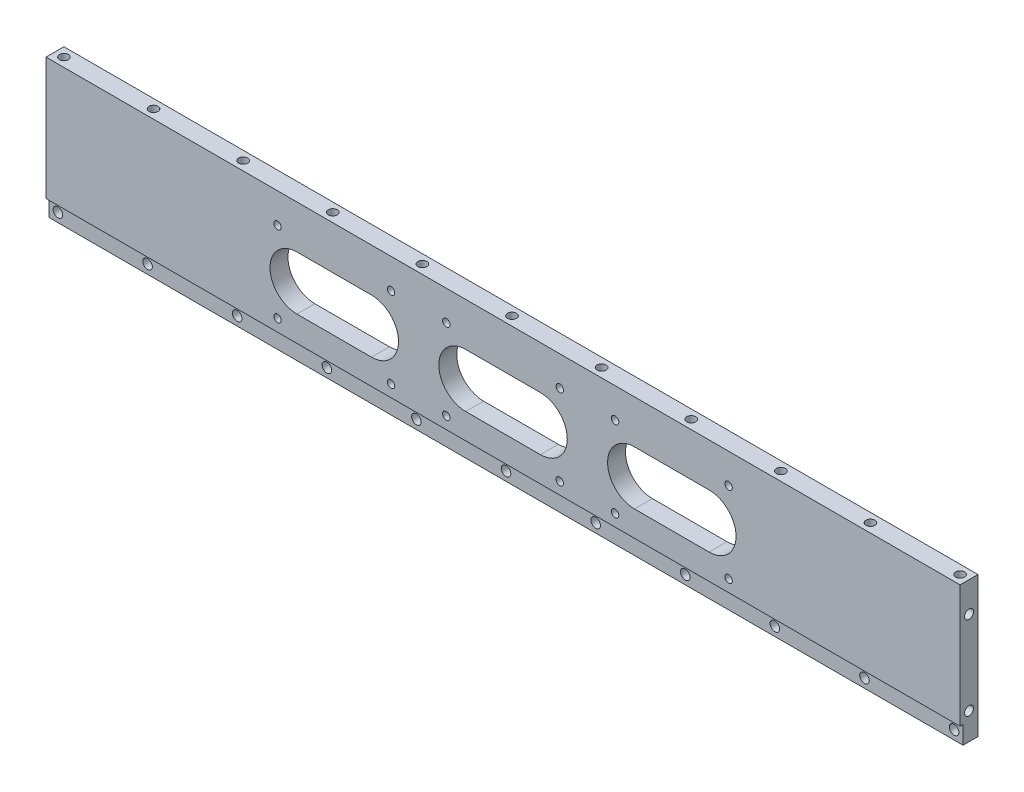
from build123d import *

# Parameters (mm, degrees)
SKETCH_1_W                     = 306
SKETCH_1_H                     = 47
EXTRUDE_1_DEPTH                = 3
CUT_EXTRUDE_START              = 3
SKETCH_1_4_W                   = 306
SKETCH_1_4_H                   = 6
CUT_EXTRUDE_1_DEPTH            = 1
M3X0_5_3_D                     = 2.5
M3X0_5_3_DEPTH                 = 8.5
M3X0_5_3_CBORE_D               = 3
M3X0_5_3_CBORE_DEPTH           = 6
M3X0_5_3_TIP                   = 0.751075774
M3X0_5_3_ON_FACE_2_D           = 2.5
M3X0_5_3_ON_FACE_2_DEPTH       = 8.5
M3X0_5_3_ON_FACE_2_CBORE_D     = 3
M3X0_5_3_ON_FACE_2_CBORE_DEPTH = 6
M3X0_5_3_ON_FACE_2_TIP         = 0.751075774
PATTERN_LINEAR_1_COUNT         = 11
PATTERN_LINEAR_1_PITCH         = 30
SKETCH_7_R                     = 1.25
CUT_EXTRUDE_2_DEPTH            = 155.910458106


with BuildPart() as part:
    # ｽｹｯﾁ1 → ﾎﾞｽ - 押し出し1 (new, symmetric)
    with BuildSketch(Plane.XY):
        Rectangle(SKETCH_1_W, SKETCH_1_H)
    extrude(amount=EXTRUDE_1_DEPTH, both=True)

    # ｽｹｯﾁ1<4> → ｶｯﾄ - 押し出し1 (cut)
    with BuildSketch(Plane.XY.offset(CUT_EXTRUDE_START)):
        with Locations((0, -20.5)):
            Rectangle(SKETCH_1_4_W, SKETCH_1_4_H)
    extrude(amount=-CUT_EXTRUDE_1_DEPTH, mode=Mode.SUBTRACT)

    # ｽｹｯﾁ2 → M3 すきま穴1 (revolve, cut)
    with BuildSketch(Plane(origin=(-150, -20.5, -3), x_dir=(0, 1, 0), z_dir=(1, 0, 0))):
        Polygon((0, 0), (0, 6.96137699), (1.6, 6), (1.6, 0), align=None)
    hole_wizard_m3_1 = revolve(axis=Axis((-150, -20.5, -9.35), (0, 0, 1)), mode=Mode.SUBTRACT)

    # M3x0.5 ねじ穴3
    with Locations(Plane(origin=(-153, 13.5, 0), x_dir=(0, 0, -1), z_dir=(-1, 0, 0))):
        with Locations((0, 0), (0, 28)):
            CounterBoreHole(M3X0_5_3_D / 2, M3X0_5_3_CBORE_D / 2, M3X0_5_3_CBORE_DEPTH, depth=M3X0_5_3_DEPTH)
            with Locations((0, 0, -(M3X0_5_3_DEPTH + M3X0_5_3_TIP / 2))):  # 118° drill point
                Cone(0, M3X0_5_3_D / 2, M3X0_5_3_TIP, mode=Mode.SUBTRACT)

    # M3x0.5 ねじ穴3 on face 2
    with Locations(Plane(origin=(153, 13.5, 0), x_dir=(0, 0, 1), z_dir=(1, 0, 0))):
        with Locations((0, 0), (0, 28)):
            CounterBoreHole(M3X0_5_3_ON_FACE_2_D / 2, M3X0_5_3_ON_FACE_2_CBORE_D / 2, M3X0_5_3_ON_FACE_2_CBORE_DEPTH, depth=M3X0_5_3_ON_FACE_2_DEPTH)
            with Locations((0, 0, -(M3X0_5_3_ON_FACE_2_DEPTH + M3X0_5_3_ON_FACE_2_TIP / 2))):  # 118° drill point
                Cone(0, M3X0_5_3_ON_FACE_2_D / 2, M3X0_5_3_ON_FACE_2_TIP, mode=Mode.SUBTRACT)

    # ｽｹｯﾁ6 → M3x0.5 ねじ穴2 (revolve, cut)
    with BuildSketch(Plane(origin=(-150, 23.5, 0), x_dir=(0, 0, 1), z_dir=(1, 0, 0))):
        Polygon((0, 0), (0, 9.251075774), (1.25, 8.5), (1.25, 6), (1.5, 6), (1.5, 0), align=None)
    m3x0_5_2 = revolve(axis=Axis((-150, 29.85, 0), (0, -1, 0)), mode=Mode.SUBTRACT)

    # 直線ﾊﾟﾀｰﾝ1: M3 すきま穴1, M3x0.5 ねじ穴2 ×11
    with Locations(*[(i * PATTERN_LINEAR_1_PITCH, 0, 0) for i in range(1, PATTERN_LINEAR_1_COUNT)]):
        add(hole_wizard_m3_1, mode=Mode.SUBTRACT)
        add(m3x0_5_2, mode=Mode.SUBTRACT)

    # ｽｹｯﾁ7 → ｶｯﾄ - 押し出し2 (cut, through all)
    with BuildSketch(Plane(origin=(0, 0, -3), x_dir=(-1, 0, 0), z_dir=(0, 0, -1))):
        with Locations((37.5, 13.5)):
            Circle(SKETCH_7_R)
        with Locations((75.5, 13.5)):
            Circle(SKETCH_7_R)
        with Locations((37.5, -13.5)):
            Circle(SKETCH_7_R)
        with Locations((75.5, -13.5)):
            Circle(SKETCH_7_R)
        with Locations((-19, 13.5)):
            Circle(SKETCH_7_R)
        with Locations((19, 13.5)):
            Circle(SKETCH_7_R)
        with Locations((-19, -13.5)):
            Circle(SKETCH_7_R)
        with Locations((19, -13.5)):
            Circle(SKETCH_7_R)
        with Locations((-75.5, 13.5)):
            Circle(SKETCH_7_R)
        with Locations((-37.5, 13.5)):
            Circle(SKETCH_7_R)
        with Locations((-75.5, -13.5)):
            Circle(SKETCH_7_R)
        with Locations((-37.5, -13.5)):
            Circle(SKETCH_7_R)
        with BuildLine():
            Line((69, -9), (44, -9))
            ThreePointArc((44, -9), (35, 0), (44, 9))
            Line((44, 9), (69, 9))
            ThreePointArc((69, 9), (78, 0), (69, -9))
        make_face()
        with BuildLine():
            Line((12.5, -9), (-12.5, -9))
            ThreePointArc((-12.5, -9), (-21.5, 0), (-12.5, 9))
            Line((-12.5, 9), (12.5, 9))
            ThreePointArc((12.5, 9), (21.5, 0), (12.5, -9))
        make_face()
        with BuildLine():
            Line((-44, -9), (-69, -9))
            ThreePointArc((-69, -9), (-78, 0), (-69, 9))
            Line((-69, 9), (-44, 9))
            ThreePointArc((-44, 9), (-35, 0), (-44, -9))
        make_face()
    extrude(amount=-CUT_EXTRUDE_2_DEPTH, mode=Mode.SUBTRACT)


solid = part.part
